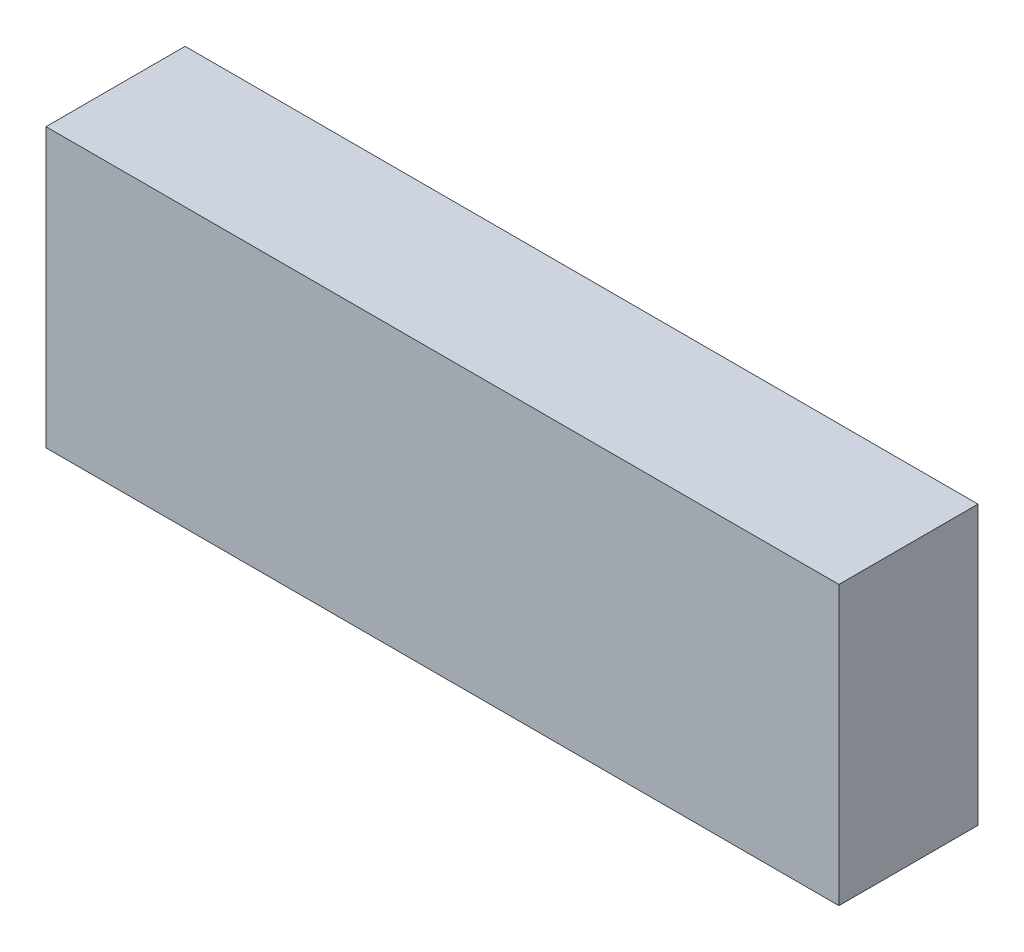
from build123d import *

# Parameters (mm, degrees)
SKETCH1_W           = 57
SKETCH1_H           = 20
BOSS_EXTRUDE1_DEPTH = 10


with BuildPart() as part:
    # Sketch1 → Boss-Extrude1 (new body)
    with BuildSketch(Plane.XY):
        with Locations((28.5, 10)):
            Rectangle(SKETCH1_W, SKETCH1_H)
    extrude(amount=-BOSS_EXTRUDE1_DEPTH)


solid = part.part
